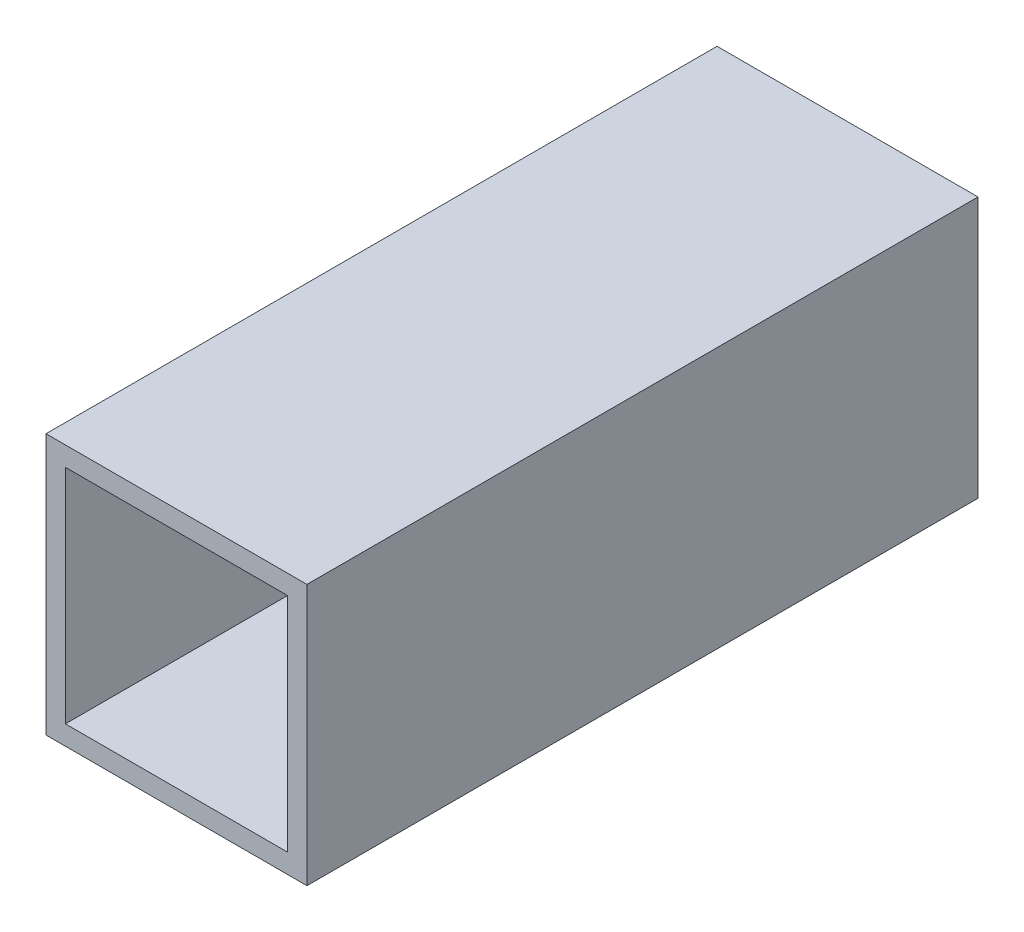
from build123d import *

# Parameters (mm, degrees)
SKETCH1_W           = 44.45
SKETCH1_H           = 44.45
SKETCH1_W_2         = 37.846
SKETCH1_H_2         = 37.846
BOSS_EXTRUDE1_DEPTH = 114.3


with BuildPart() as part:
    # Sketch1 → Boss-Extrude1 (new body)
    with BuildSketch(Plane.XY):
        Rectangle(SKETCH1_W, SKETCH1_H)
        Rectangle(SKETCH1_W_2, SKETCH1_H_2, mode=Mode.SUBTRACT)
    extrude(amount=BOSS_EXTRUDE1_DEPTH)


solid = part.part
